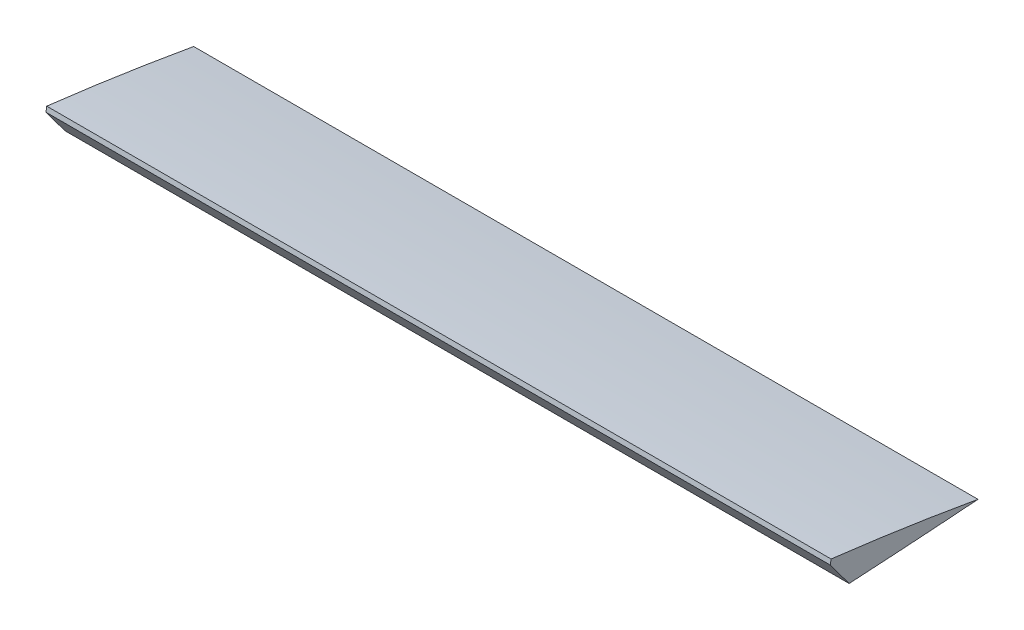
from build123d import *

# Parameters (mm, degrees)
BOSS_EXTRUDE1_DEPTH     = 187.325
CUT_EXTRUDE1_DEPTH      = 201.609540594
CUT_EXTRUDE1_DEPTH_BACK = 201.609540594


with BuildPart() as part:
    # Sketch1 → Boss-Extrude1 (new, symmetric)
    with BuildSketch(Plane(origin=(0, 0, -687.861633966), x_dir=(0, 0, 1), z_dir=(-1, 0, 0))):
        with BuildLine():
            Line((687.861633966, 0), (690.096455666, -15.062896864))
            ThreePointArc((690.096455666, -15.062896864), (653.871932536, -12.926756957), (617.671596993, -10.413815205))
            ThreePointArc((617.671596993, -10.413815205), (652.692390456, -4.706624369), (687.861633966, 0))
        make_face()
    extrude(amount=BOSS_EXTRUDE1_DEPTH, both=True)

    # Sketch2 → Cut-Extrude1 (cut, two sides: drawn at the far end of the back side and taken through both)
    with BuildSketch(Plane(origin=(0, 0, 0), x_dir=(0, 0, -1), z_dir=(1, 0, 0)).offset(-CUT_EXTRUDE1_DEPTH_BACK)):
        with BuildLine():
            Line((-0.349471105, -2.355466304), (8.628779259, -14.461978467))
            ThreePointArc((8.628779259, -14.461978467), (3.197213125, -14.766674235), (-2.2348217, -15.062896864))
            Line((-2.2348217, -15.062896864), (-0.349471105, -2.355466304))
        make_face()
    extrude(amount=CUT_EXTRUDE1_DEPTH + CUT_EXTRUDE1_DEPTH_BACK, mode=Mode.SUBTRACT)


solid = part.part
